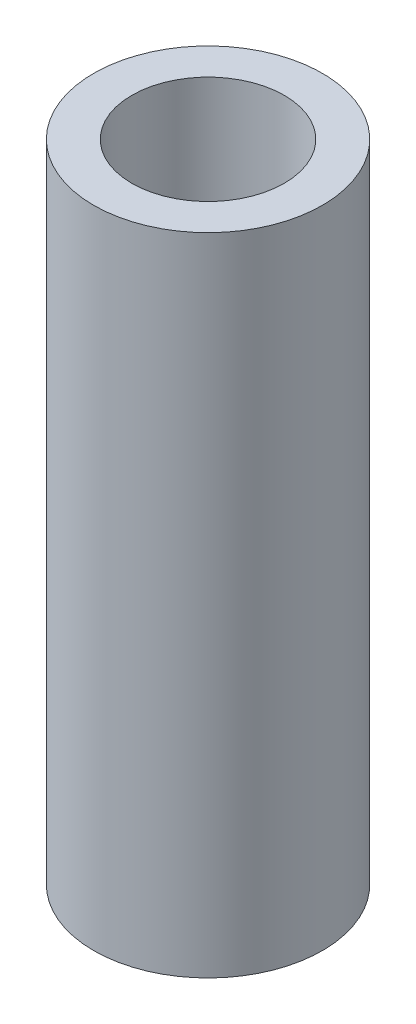
from build123d import *

# Parameters (mm, degrees)
SKETCH1_R           = 4.5
SKETCH1_R_2         = 3
BOSS_EXTRUDE1_DEPTH = 25.4


with BuildPart() as part:
    # Sketch1 → Boss-Extrude1 (new body)
    with BuildSketch(Plane(origin=(0, 0, 0), x_dir=(1, 0, 0), z_dir=(0, 1, 0))):
        with Locations(Location((0, 0, 0), (0, 0, 270))):
            Circle(SKETCH1_R)
        with Locations(Location((0, 0, 0), (0, 0, 270))):
            Circle(SKETCH1_R_2, mode=Mode.SUBTRACT)
    extrude(amount=BOSS_EXTRUDE1_DEPTH)


solid = part.part
